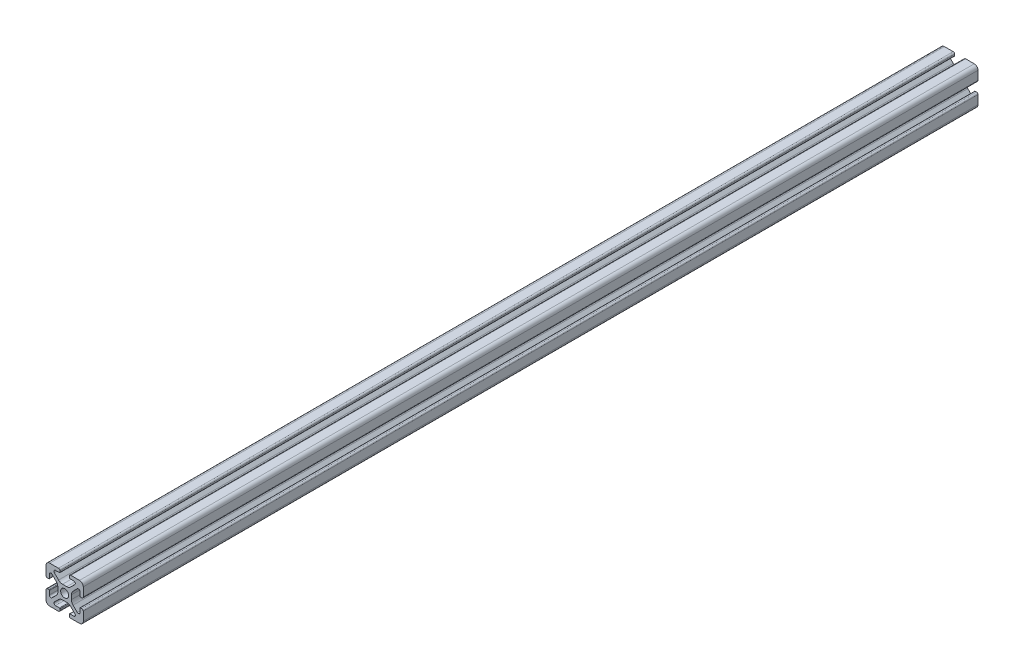
from build123d import *

# Parameters (mm, degrees)
BOSS_EXTRU_1_DEPTH = 480


with BuildPart() as part:
    # Esquisse1 → Boss.-Extru.1 (new body)
    with BuildSketch(Plane.XY):
        with BuildLine():
            Line((-3.255887446, 4.528679645), (-5.506192286, 6.778984485))
            ThreePointArc((-5.506192286, 6.778984485), (-5.686636441, 7.686138511), (-4.917588391, 8.199999989))
            Line((-4.917588391, 8.199999989), (-2.799999991, 8.199999989))
            ThreePointArc((-2.799999991, 8.199999989), (-2.587867957, 8.287867955), (-2.499999991, 8.499999989))
            Line((-2.499999991, 8.499999989), (-2.499999991, 9.199999989))
            ThreePointArc((-2.499999991, 9.199999989), (-2.734314566, 9.765685414), (-3.299999991, 9.999999989))
            Line((-3.299999991, 9.999999989), (-7.999999991, 9.999999989))
            ThreePointArc((-7.999999991, 9.999999989), (-9.414213554, 9.414213552), (-9.999999991, 7.999999989))
            Line((-9.999999991, 7.999999989), (-9.999999991, 3.299999989))
            ThreePointArc((-9.999999991, 3.299999989), (-9.765685416, 2.734314564), (-9.199999991, 2.499999989))
            Line((-9.199999991, 2.499999989), (-8.499999991, 2.499999989))
            ThreePointArc((-8.499999991, 2.499999989), (-8.287867957, 2.587867955), (-8.199999991, 2.799999989))
            Line((-8.199999991, 2.799999989), (-8.199999991, 4.917588389))
            ThreePointArc((-8.199999991, 4.917588389), (-7.686138517, 5.686636433), (-6.778984497, 5.506192279))
            Line((-6.778984497, 5.506192279), (-4.528679657, 3.255887439))
            ThreePointArc((-4.528679657, 3.255887439), (-3.878361403, 2.282617393), (-3.650000001, 1.134567096))
            Line((-3.650000001, 1.134567096), (-3.650000001, -1.134567114))
            ThreePointArc((-3.650000001, -1.134567114), (-3.878361403, -2.282617409), (-4.528679656, -3.255887454))
            Line((-4.528679656, -3.255887454), (-6.778984496, -5.506192294))
            ThreePointArc((-6.778984496, -5.506192294), (-7.686138522, -5.686636449), (-8.2, -4.9175884))
            Line((-8.2, -4.9175884), (-8.2, -2.8))
            ThreePointArc((-8.2, -2.8), (-8.287867966, -2.587867966), (-8.5, -2.5))
            Line((-8.5, -2.5), (-9.2, -2.5))
            ThreePointArc((-9.2, -2.5), (-9.765685425, -2.734314575), (-10, -3.3))
            Line((-10, -3.3), (-10, -8))
            ThreePointArc((-10, -8), (-9.414213562, -9.414213562), (-8, -10))
            Line((-8, -10), (-3.3, -10))
            ThreePointArc((-3.3, -10), (-2.734314575, -9.765685425), (-2.5, -9.2))
            Line((-2.5, -9.2), (-2.5, -8.5))
            ThreePointArc((-2.5, -8.5), (-2.587867966, -8.287867966), (-2.8, -8.2))
            Line((-2.8, -8.2), (-4.9175884, -8.2))
            ThreePointArc((-4.9175884, -8.2), (-5.686636444, -7.686138526), (-5.50619229, -6.778984506))
            Line((-5.50619229, -6.778984506), (-3.25588745, -4.528679666))
            ThreePointArc((-3.25588745, -4.528679666), (-2.282617404, -3.878361412), (-1.134567106, -3.650000009))
            Line((-1.134567106, -3.650000009), (1.134567104, -3.650000009))
            ThreePointArc((1.134567104, -3.650000009), (2.282617399, -3.878361412), (3.255887444, -4.528679664))
            Line((3.255887444, -4.528679664), (5.506192284, -6.778984504))
            ThreePointArc((5.506192284, -6.778984504), (5.686636439, -7.686138531), (4.917588389, -8.200000009))
            Line((4.917588389, -8.200000009), (2.799999989, -8.200000009))
            ThreePointArc((2.799999989, -8.200000009), (2.587867955, -8.287867974), (2.499999989, -8.500000009))
            Line((2.499999989, -8.500000009), (2.499999989, -9.200000009))
            ThreePointArc((2.499999989, -9.200000009), (2.734314564, -9.765685434), (3.299999989, -10.000000009))
            Line((3.299999989, -10.000000009), (7.999999989, -10.000000009))
            ThreePointArc((7.999999989, -10.000000009), (9.414213552, -9.414213571), (9.999999989, -8.000000009))
            Line((9.999999989, -8.000000009), (9.999999989, -3.300000009))
            ThreePointArc((9.999999989, -3.300000009), (9.765685414, -2.734314584), (9.199999989, -2.500000009))
            Line((9.199999989, -2.500000009), (8.499999989, -2.500000009))
            ThreePointArc((8.499999989, -2.500000009), (8.287867955, -2.587867974), (8.199999989, -2.800000009))
            Line((8.199999989, -2.800000009), (8.199999989, -4.917588409))
            ThreePointArc((8.199999989, -4.917588409), (7.686138515, -5.686636452), (6.778984495, -5.506192299))
            Line((6.778984495, -5.506192299), (4.528679655, -3.255887459))
            ThreePointArc((4.528679655, -3.255887459), (3.878361401, -2.282617412), (3.649999999, -1.134567115))
            Line((3.649999999, -1.134567115), (3.649999999, 1.134567095))
            ThreePointArc((3.649999999, 1.134567095), (3.878361401, 2.28261739), (4.528679654, 3.255887435))
            Line((4.528679654, 3.255887435), (6.778984494, 5.506192275))
            ThreePointArc((6.778984494, 5.506192275), (7.68613852, 5.68663643), (8.199999998, 4.917588381))
            Line((8.199999998, 4.917588381), (8.199999998, 2.799999981))
            ThreePointArc((8.199999998, 2.799999981), (8.287867964, 2.587867946), (8.499999998, 2.499999981))
            Line((8.499999998, 2.499999981), (9.199999998, 2.499999981))
            ThreePointArc((9.199999998, 2.499999981), (9.765685423, 2.734314556), (9.999999998, 3.299999981))
            Line((9.999999998, 3.299999981), (9.999999998, 7.999999981))
            ThreePointArc((9.999999998, 7.999999981), (9.41421356, 9.414213543), (7.999999998, 9.999999981))
            Line((7.999999998, 9.999999981), (3.299999998, 9.999999981))
            ThreePointArc((3.299999998, 9.999999981), (2.734314573, 9.765685406), (2.499999998, 9.199999981))
            Line((2.499999998, 9.199999981), (2.499999998, 8.499999981))
            ThreePointArc((2.499999998, 8.499999981), (2.587867964, 8.287867946), (2.799999998, 8.199999981))
            Line((2.799999998, 8.199999981), (4.917588398, 8.199999981))
            ThreePointArc((4.917588398, 8.199999981), (5.686636442, 7.686138507), (5.506192288, 6.778984487))
            Line((5.506192288, 6.778984487), (3.255887448, 4.528679647))
            ThreePointArc((3.255887448, 4.528679647), (2.282617402, 3.878361393), (1.134567104, 3.64999999))
            Line((1.134567104, 3.64999999), (-1.134567106, 3.64999999))
            ThreePointArc((-1.134567106, 3.64999999), (-2.282617401, 3.878361392), (-3.255887446, 4.528679645))
        make_face()
        with BuildLine():
            ThreePointArc((-2.15, 0), (0, -2.15), (2.15, 0))
            ThreePointArc((2.15, 0), (0, 2.15), (-2.15, 0))
        make_face(mode=Mode.SUBTRACT)
    extrude(amount=BOSS_EXTRU_1_DEPTH)


solid = part.part
